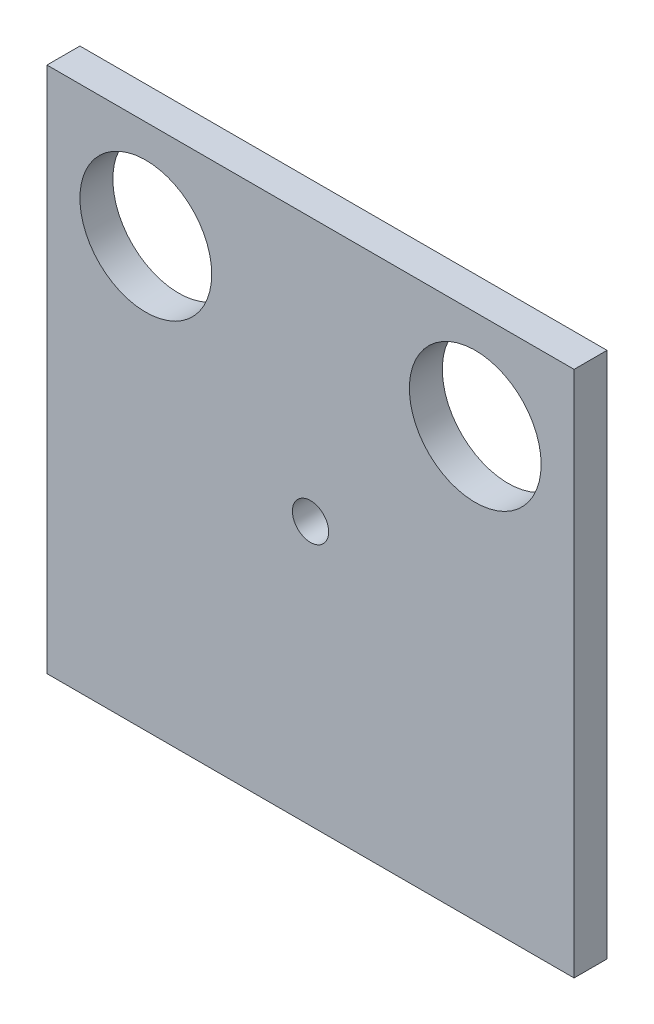
from build123d import *

# Parameters (mm, degrees)
SKETCH1_W           = 101.6
SKETCH1_H           = 101.6
SKETCH1_R           = 12.7
SKETCH1_R_2         = 3.4925
BOSS_EXTRUDE1_DEPTH = 6.35


with BuildPart() as part:
    # Sketch1 → Boss-Extrude1 (new body)
    with BuildSketch(Plane.XY):
        with Locations((50.8, 50.8)):
            Rectangle(SKETCH1_W, SKETCH1_H)
        with Locations((19.05, 82.55)):
            Circle(SKETCH1_R, mode=Mode.SUBTRACT)
        with Locations((82.55, 82.55)):
            Circle(SKETCH1_R, mode=Mode.SUBTRACT)
        with Locations((50.8, 50.8)):
            Circle(SKETCH1_R_2, mode=Mode.SUBTRACT)
    extrude(amount=BOSS_EXTRUDE1_DEPTH)


solid = part.part
